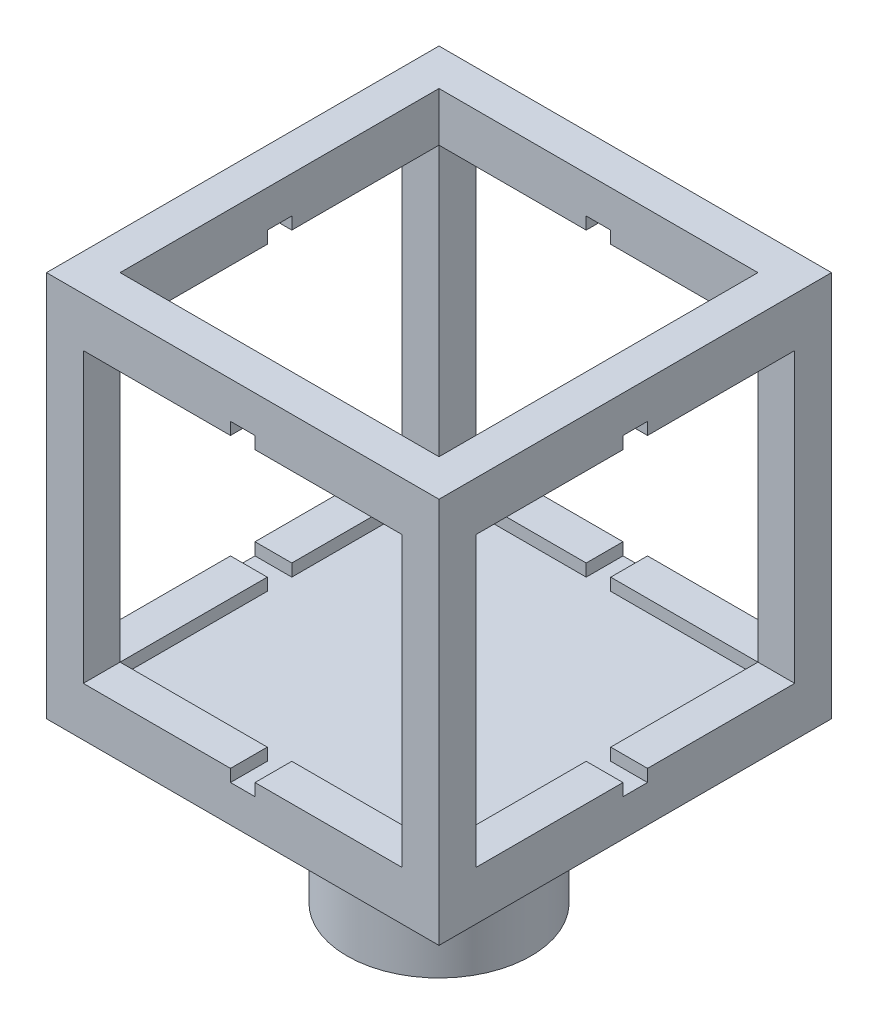
from build123d import *

# Parameters (mm, degrees)
ESQUISSE1_R             = 7.5
BOSS_EXTRU_1_DEPTH      = 12
ESQUISSE2_R             = 8.5
BOSS_EXTRU_2_DEPTH      = 1
ESQUISSE3_W             = 32
ESQUISSE3_H             = 32
ESQUISSE3_W_2           = 26
ESQUISSE3_H_2           = 26
ESQUISSE3_R             = 8.5
BOSS_EXTRU_3_DEPTH      = 31.5
ESQUISSE7_W             = 26
ESQUISSE7_H             = 26
ENL_V_MAT_EXTRU_2_DEPTH = 37.390245946
ESQUISSE8_W             = 26
ESQUISSE8_H             = 25.5
ENL_V_MAT_EXTRU_3_DEPTH = 49.334770094
ESQUISSE9_W             = 26
ESQUISSE9_H             = 25.5
ENL_V_MAT_EXTRU_4_DEPTH = 49.334770094
ESQUISSE10_W            = 12
ESQUISSE10_H            = 3
ESQUISSE10_W_2          = 3
ESQUISSE10_H_2          = 12
BOSS_EXTRU_5_DEPTH      = 1
ESQUISSE12_W            = 3
ESQUISSE12_H            = 12
BOSS_EXTRU_9_DEPTH      = 1
ESQUISSE13_W            = 12
ESQUISSE13_H            = 3
BOSS_EXTRU_10_DEPTH     = 1


with BuildPart() as part:
    # Esquisse1 → Boss.-Extru.1 (new body)
    with BuildSketch(Plane(origin=(0, 0, 0), x_dir=(1, 0, 0), z_dir=(0, 1, 0))):
        with Locations(Location((0, 0, 0), (0, 0, 270))):
            Circle(ESQUISSE1_R)
    extrude(amount=-BOSS_EXTRU_1_DEPTH)

    # Esquisse2 → Boss.-Extru.2 (add)
    with BuildSketch(Plane(origin=(0, 0, 0), x_dir=(1, 0, 0), z_dir=(0, 1, 0))):
        with Locations(Location((0, 0, 0), (0, 0, 270))):
            Circle(ESQUISSE2_R)
    extrude(amount=BOSS_EXTRU_2_DEPTH)


with BuildPart() as body_2:
    # Esquisse3 → Boss.-Extru.3 (new body)
    # profile 1 of 3: a face of its own
    with BuildSketch(Plane(origin=(0, 1, 0), x_dir=(1, 0, 0), z_dir=(0, 1, 0))):
        Rectangle(ESQUISSE3_W, ESQUISSE3_H)
        Rectangle(ESQUISSE3_W_2, ESQUISSE3_H_2, mode=Mode.SUBTRACT)
    # profile 2 of 3: a face of its own
    with BuildSketch(Plane(origin=(0, 1, 0), x_dir=(1, 0, 0), z_dir=(0, 1, 0))):
        Rectangle(ESQUISSE3_W_2, ESQUISSE3_H_2)
        with Locations(Location((0, 0, 0), (0, 0, 270))):
            Circle(ESQUISSE3_R, mode=Mode.SUBTRACT)
    # profile 3 of 3: a face of its own
    with BuildSketch(Plane(origin=(0, 1, 0), x_dir=(1, 0, 0), z_dir=(0, 1, 0))):
        with Locations(Location((0, 0, 0), (0, 0, 270))):
            Circle(ESQUISSE3_R)
    extrude(amount=BOSS_EXTRU_3_DEPTH)

    # Esquisse7 → Enlèv. mat.-Extru.2 (cut, through all)
    with BuildSketch(Plane(origin=(0, 4, 0), x_dir=(-1, 0, 0), z_dir=(0, -1, 0))):
        Rectangle(ESQUISSE7_W, ESQUISSE7_H)
    extrude(amount=-ENL_V_MAT_EXTRU_2_DEPTH, mode=Mode.SUBTRACT)

    # Esquisse8 → Enlèv. mat.-Extru.3 (cut, through all)
    with BuildSketch(Plane.ZY.offset(16)):
        with Locations((0, 16.75)):
            Rectangle(ESQUISSE8_W, ESQUISSE8_H)
    extrude(amount=-ENL_V_MAT_EXTRU_3_DEPTH, mode=Mode.SUBTRACT)

    # Esquisse9 → Enlèv. mat.-Extru.4 (cut, through all)
    with BuildSketch(Plane(origin=(0, 0, -16), x_dir=(-1, 0, 0), z_dir=(0, 0, -1))):
        with Locations((0, 16.75)):
            Rectangle(ESQUISSE9_W, ESQUISSE9_H)
    extrude(amount=-ENL_V_MAT_EXTRU_4_DEPTH, mode=Mode.SUBTRACT)

    # Esquisse10 → Boss.-Extru.5 (add)
    with BuildSketch(Plane(origin=(0, 4, 0), x_dir=(1, 0, 0), z_dir=(0, 1, 0))):
        with Locations((-7, 14.5)):
            Rectangle(ESQUISSE10_W, ESQUISSE10_H)
        with Locations((7, 14.5)):
            Rectangle(ESQUISSE10_W, ESQUISSE10_H)
        with Locations((14.5, 7)):
            Rectangle(ESQUISSE10_W_2, ESQUISSE10_H_2)
        with Locations((14.5, -7)):
            Rectangle(ESQUISSE10_W_2, ESQUISSE10_H_2)
        with Locations((7, -14.5)):
            Rectangle(ESQUISSE10_W, ESQUISSE10_H)
        with Locations((-7, -14.5)):
            Rectangle(ESQUISSE10_W, ESQUISSE10_H)
        with Locations((-14.5, -7)):
            Rectangle(ESQUISSE10_W_2, ESQUISSE10_H_2)
        with Locations((-14.5, 7)):
            Rectangle(ESQUISSE10_W_2, ESQUISSE10_H_2)
    extrude(amount=BOSS_EXTRU_5_DEPTH)

    # Esquisse12 → Boss.-Extru.9 (add)
    with BuildSketch(Plane.XZ.offset(-29.5)):
        with Locations((-14.5, 7)):
            Rectangle(ESQUISSE12_W, ESQUISSE12_H)
        with Locations((-14.5, -7)):
            Rectangle(ESQUISSE12_W, ESQUISSE12_H)
        with Locations((14.5, 7)):
            Rectangle(ESQUISSE12_W, ESQUISSE12_H)
        with Locations((14.5, -7)):
            Rectangle(ESQUISSE12_W, ESQUISSE12_H)
    extrude(amount=BOSS_EXTRU_9_DEPTH)

    # Esquisse13 → Boss.-Extru.10 (add)
    with BuildSketch(Plane.XZ.offset(-29.5)):
        with Locations((-7, -14.5)):
            Rectangle(ESQUISSE13_W, ESQUISSE13_H)
        with Locations((7, -14.5)):
            Rectangle(ESQUISSE13_W, ESQUISSE13_H)
        with Locations((-7, 14.5)):
            Rectangle(ESQUISSE13_W, ESQUISSE13_H)
        with Locations((7, 14.5)):
            Rectangle(ESQUISSE13_W, ESQUISSE13_H)
    extrude(amount=BOSS_EXTRU_10_DEPTH)


solid = Compound([part.part, body_2.part])
